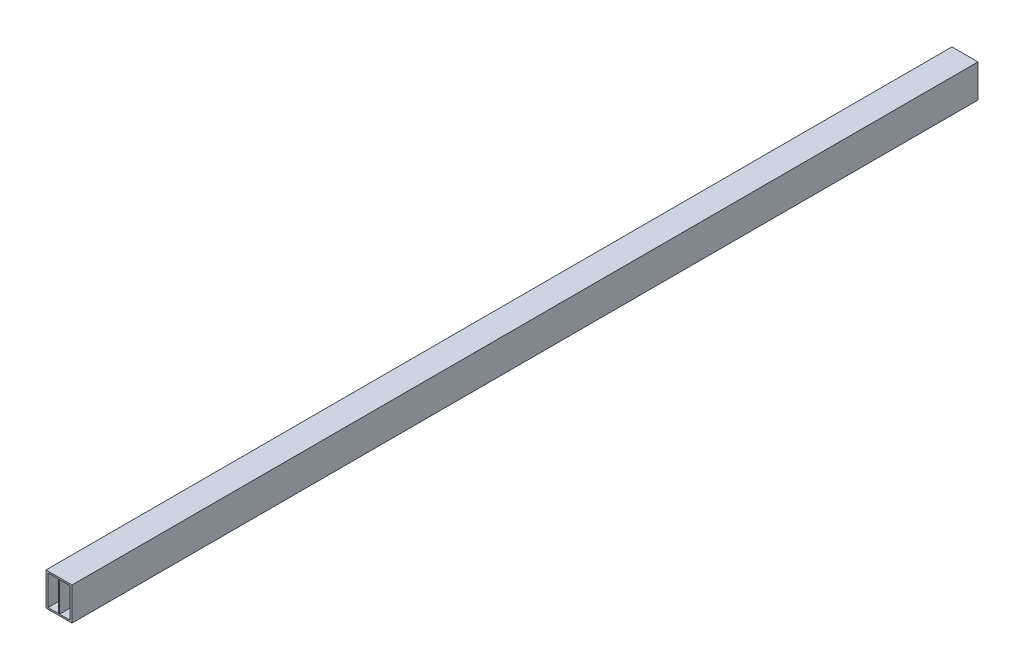
from build123d import *

# Parameters (mm, degrees)
BOSS_EXTRUDE1_DEPTH = 4200
SKETCH3_W           = 4200
SKETCH3_H           = 153.162
BOSS_EXTRUDE2_DEPTH = 9.525
SKETCH4_W           = 4200
SKETCH4_H           = 153.162
BOSS_EXTRUDE3_DEPTH = 9.525


with BuildPart() as part:
    # Sketch1 → Boss-Extrude1 (new body)
    with BuildSketch(Plane.XY):
        Polygon((0, -0.000240533), (101.6, -0.000240533), (101.6, -7.112240533), (53.408035714, -7.112240533), (53.408035714, -146.050240533), (101.6, -146.050240533), (101.6, -153.162240533), (0, -153.162240533), (0, -146.050240533), (47.566035714, -146.050240533), (47.566035714, -7.112240533), (0, -7.112240533), align=None)
    extrude(amount=BOSS_EXTRUDE1_DEPTH)

    # Sketch3 → Boss-Extrude2 (add)
    with BuildSketch(Plane(origin=(101.6, 0, 0), x_dir=(0, 0, -1), z_dir=(1, 0, 0))):
        with Locations((-2100, -76.581240533)):
            Rectangle(SKETCH3_W, SKETCH3_H)
    extrude(amount=BOSS_EXTRUDE2_DEPTH)

    # Sketch4 → Boss-Extrude3 (add)
    with BuildSketch(Plane.ZY):
        with Locations((2100, -76.581240533)):
            Rectangle(SKETCH4_W, SKETCH4_H)
    extrude(amount=BOSS_EXTRUDE3_DEPTH)


solid = part.part
